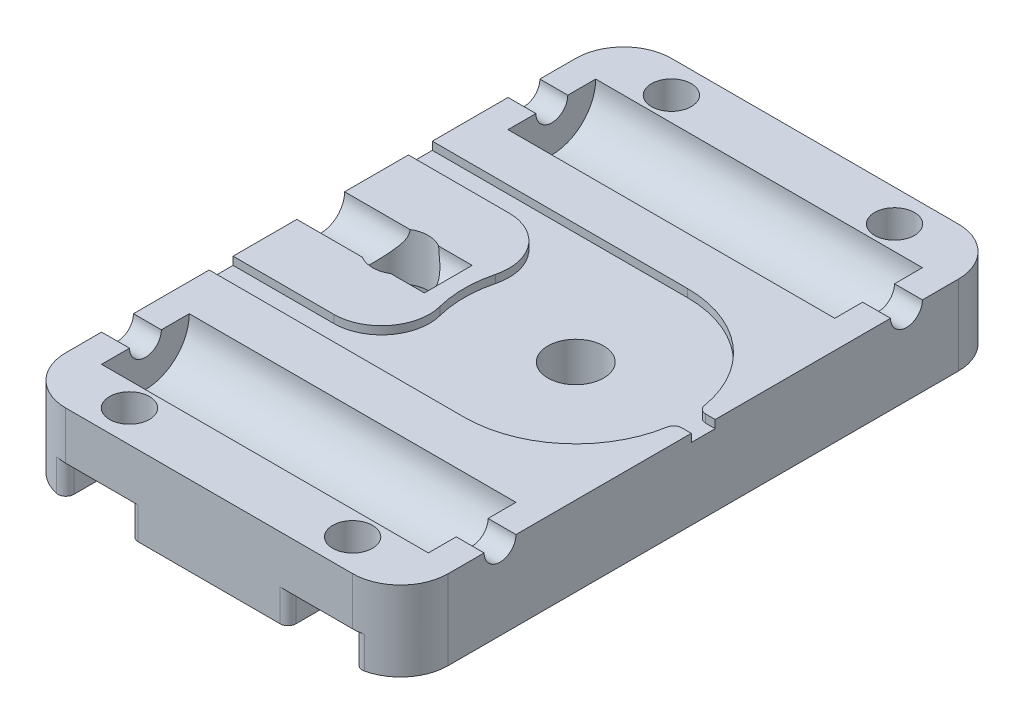
from build123d import *

# Parameters (mm, degrees)
SKETCH_1_W               = 24
SKETCH_1_H               = 38
EXTRUDE_1_DEPTH          = 5
SKETCH_2_R               = 2.75
CUT_EXTRUDE_1_DEPTH      = 10.25
CUT_EXTRUDE_2_DEPTH      = 24.021728866
CUT_EXTRUDE_2_DEPTH_BACK = 24.021728866
SKETCH_3_R               = 1
CUT_EXTRUDE_3_DEPTH      = 0.5
SKETCH_5_R               = 1.75
CUT_EXTRUDE_4_DEPTH      = 24.021728866
FILLET_1_R               = 3
FILLET_2_R               = 3
SKETCH_6_R               = 1.5
CUT_EXTRUDE_5_DEPTH      = 8
FILLET_3_R               = 0.5
SKETCH_7_R               = 1.25
CUT_EXTRUDE_6_DEPTH      = 24.02172894
SKETCH_8_R               = 3
CUT_EXTRUDE_7_DEPTH      = 2
CUT_EXTRUDE_8_DEPTH      = 2
FILLET_4_R               = 0.5


with BuildPart() as part:
    # Эскиз1 → Бобышка-Вытянуть1 (new body)
    with BuildSketch(Plane(origin=(0, 0, 0), x_dir=(1, 0, 0), z_dir=(0, 1, 0))):
        Rectangle(SKETCH_1_W, SKETCH_1_H)
    extrude(amount=EXTRUDE_1_DEPTH)

    # Эскиз2 → Вырез-Вытянуть1 (cut, symmetric)
    with BuildSketch(Plane(origin=(0, 0, 0), x_dir=(0, 0, -1), z_dir=(1, 0, 0))):
        with Locations((-12.75, 5)):
            Circle(SKETCH_2_R)
        with Locations((12.75, 5)):
            Circle(SKETCH_2_R)
    extrude(amount=CUT_EXTRUDE_1_DEPTH, both=True, mode=Mode.SUBTRACT)

    # Эскиз3 → Вырез-Вытянуть2 (cut, two sides: drawn at the far end of the back side and taken through both)
    with BuildSketch(Plane(origin=(0, 0, 0), x_dir=(0, 0, -1), z_dir=(1, 0, 0)).offset(-CUT_EXTRUDE_2_DEPTH_BACK)):
        with Locations((-12.75, 5)):
            Circle(SKETCH_3_R)
        with Locations((12.75, 5)):
            Circle(SKETCH_3_R)
    extrude(amount=CUT_EXTRUDE_2_DEPTH + CUT_EXTRUDE_2_DEPTH_BACK, mode=Mode.SUBTRACT)

    # Эскиз4 → Вырез-Вытянуть3 (cut)
    with BuildSketch(Plane(origin=(0, 5, 0), x_dir=(1, 0, 0), z_dir=(0, 1, 0))):
        with BuildLine():
            Line((4, 7), (-12, 7))
            Line((-12, 7), (-12, 5.5))
            Line((-12, 5.5), (-0.330127019, 5.5))
            ThreePointArc((-0.330127019, 5.5), (-3, 0), (-0.330127019, -5.5))
            Line((-0.330127019, -5.5), (-12, -5.5))
            Line((-12, -5.5), (-12, -7))
            Line((-12, -7), (4, -7))
            ThreePointArc((4, -7), (8.677071733, -5.208166664), (10.959705454, -0.75))
            Line((10.959705454, -0.75), (12, -0.75))
            Line((12, -0.75), (12, 0.75))
            Line((12, 0.75), (10.959705454, 0.75))
            ThreePointArc((10.959705454, 0.75), (8.677071733, 5.208166664), (4, 7))
        make_face()
    extrude(amount=-CUT_EXTRUDE_3_DEPTH, mode=Mode.SUBTRACT)

    # Эскиз5 → Вырез-Вытянуть4 (cut, through all)
    with BuildSketch(Plane(origin=(0, 5, 0), x_dir=(1, 0, 0), z_dir=(0, 1, 0))):
        with Locations(Location((4, 0, 0), (0, 0, 270))):
            Circle(SKETCH_5_R)
        with Locations(Location((-7, 0, 0), (0, 0, 270))):
            Circle(SKETCH_5_R)
    extrude(amount=-CUT_EXTRUDE_4_DEPTH, mode=Mode.SUBTRACT)

    # Скругление1
    fillet_1_edges = [part.edges().sort_by_distance(p)[0] for p in [
        (-0.330127019, 4.75, 5.5),
        (-0.330127019, 4.75, -5.5),
    ]]
    fillet(fillet_1_edges, radius=FILLET_1_R)

    # Скругление2
    fillet_2_edges = [part.edges().sort_by_distance(p)[0] for p in [
        (12, 2.5, 19),
        (-12, 2.5, 19),
        (-12, 2.5, -19),
        (12, 2.5, -19),
    ]]
    fillet(fillet_2_edges, radius=FILLET_2_R)

    # Эскиз6 → Вырез-Вытянуть5 (cut)
    with BuildSketch(Plane.ZY.offset(12)):
        with Locations((0, 5)):
            Circle(SKETCH_6_R)
    extrude(amount=-CUT_EXTRUDE_5_DEPTH, mode=Mode.SUBTRACT)

    # Скругление3
    fillet_3_edges = [part.edges().sort_by_distance(p)[0] for p in [
        (10.959705454, 4.75, -0.75),
        (10.959705454, 4.75, 0.75),
    ]]
    fillet(fillet_3_edges, radius=FILLET_3_R)

    # Эскиз7 → Вырез-Вытянуть6 (cut, through all)
    with BuildSketch(Plane(origin=(0, 5, 0), x_dir=(1, 0, 0), z_dir=(0, 1, 0))):
        with Locations(Location((-7, 17, 0), (0, 0, 270))):
            Circle(SKETCH_7_R)
        with Locations(Location((7, 17, 0), (0, 0, 270))):
            Circle(SKETCH_7_R)
        with Locations(Location((7, -17, 0), (0, 0, 270))):
            Circle(SKETCH_7_R)
        with Locations(Location((-7, -17, 0), (0, 0, 270))):
            Circle(SKETCH_7_R)
    extrude(amount=-CUT_EXTRUDE_6_DEPTH, mode=Mode.SUBTRACT)

    # Эскиз8 → Вырез-Вытянуть7 (cut)
    with BuildSketch(Plane.XZ):
        with Locations(Location((4, 0, 0), (0, 0, 270))):
            Circle(SKETCH_8_R)
        with Locations(Location((-7, 0, 0), (0, 0, 270))):
            Circle(SKETCH_8_R)
    extrude(amount=-CUT_EXTRUDE_7_DEPTH, mode=Mode.SUBTRACT)

    # Эскиз9 → Вырез-Вытянуть8 (cut)
    with BuildSketch(Plane.XZ):
        with BuildLine():
            Line((-9.05, 17), (-9.05, 20))
            Line((-9.05, 20), (-4.95, 20))
            Line((-4.95, 20), (-4.95, 17))
            ThreePointArc((-4.95, 17), (-7, 14.95), (-9.05, 17))
        make_face()
        with BuildLine():
            Line((9.05, 17), (9.05, 20))
            Line((9.05, 20), (4.95, 20))
            Line((4.95, 20), (4.95, 17))
            ThreePointArc((4.95, 17), (7, 14.95), (9.05, 17))
        make_face()
        with BuildLine():
            Line((4.95, -20), (4.95, -17))
            ThreePointArc((4.95, -17), (7, -14.95), (9.05, -17))
            Line((9.05, -17), (9.05, -20))
            Line((9.05, -20), (4.95, -20))
        make_face()
        with BuildLine():
            Line((-9.05, -17), (-9.05, -20))
            Line((-9.05, -20), (-4.95, -20))
            Line((-4.95, -20), (-4.95, -17))
            ThreePointArc((-4.95, -17), (-7, -14.95), (-9.05, -17))
        make_face()
    extrude(amount=-CUT_EXTRUDE_8_DEPTH, mode=Mode.SUBTRACT)

    # Скругление4
    fillet_4_edges = [part.edges().sort_by_distance(p)[0] for p in [
        (9.05, 1, 18.999583304),
        (-9.05, 1, 18.999583304),
        (9.05, 1, -18.999583304),
        (-9.05, 1, -18.999583304),
        (-4.95, 1, -19),
        (4.95, 1, -19),
        (4.95, 1, 19),
        (-4.95, 1, 19),
    ]]
    fillet(fillet_4_edges, radius=FILLET_4_R)


solid = part.part
